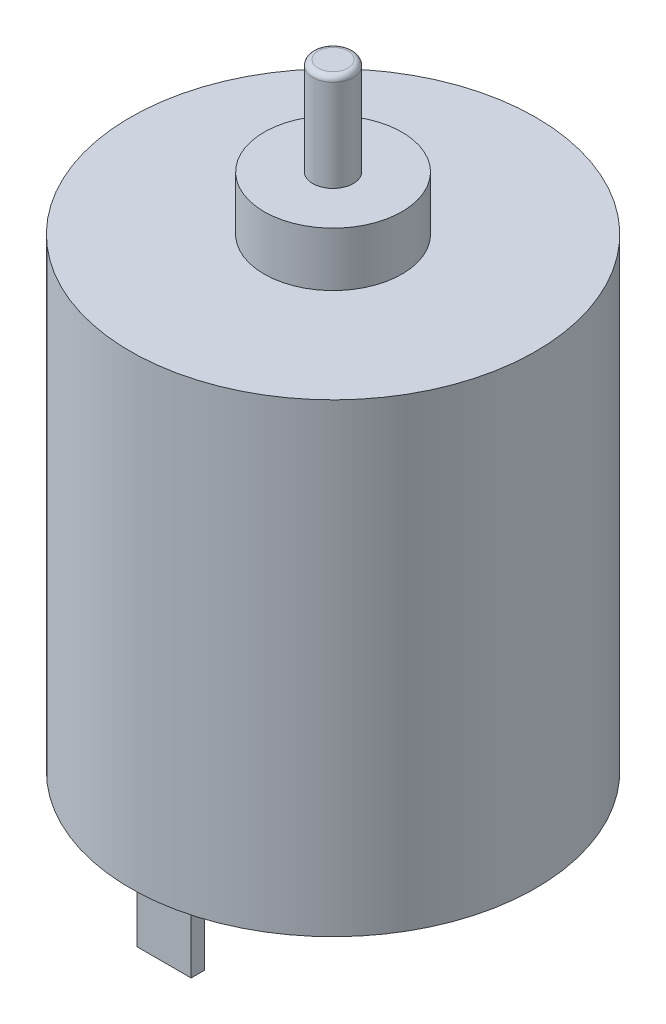
from build123d import *

# Parameters (mm, degrees)
SKETCH_1_R      = 7.5
EXTRUDE_1_DEPTH = 17.2
SKETCH_2_R      = 2.55
EXTRUDE_2_DEPTH = 2
SKETCH_3_R      = 0.75
EXTRUDE_3_DEPTH = 3.6
SKETCH_4_W      = 2
SKETCH_4_H      = 0.5
EXTRUDE_4_DEPTH = 3
FILLET_2_R      = 0.2


with BuildPart() as part:
    # 草圖1 → 伸長1 (new body)
    with BuildSketch(Plane(origin=(0, 0, 0), x_dir=(1, 0, 0), z_dir=(0, 1, 0))):
        with Locations(Location((0, 0, 0), (0, 0, 90))):
            Circle(SKETCH_1_R)
    extrude(amount=EXTRUDE_1_DEPTH)

    # 草圖2 → 伸長2 (add)
    with BuildSketch(Plane(origin=(0, 17.2, 0), x_dir=(1, 0, 0), z_dir=(0, 1, 0))):
        with Locations(Location((0, 0, 0), (0, 0, 270))):
            Circle(SKETCH_2_R)
    extrude(amount=EXTRUDE_2_DEPTH)

    # 草圖3 → 伸長3 (add)
    with BuildSketch(Plane(origin=(0, 19.2, 0), x_dir=(-1, 0, 0), z_dir=(0, 1, 0))):
        with Locations(Location((0, 0, 0), (0, 0, 90))):
            Circle(SKETCH_3_R)
    extrude(amount=EXTRUDE_3_DEPTH)

    # 草圖4 → 伸長4 (add)
    with BuildSketch(Plane.XZ):
        with Locations((0, 6)):
            Rectangle(SKETCH_4_W, SKETCH_4_H)
        with Locations((0, -6)):
            Rectangle(SKETCH_4_W, SKETCH_4_H)
    extrude(amount=EXTRUDE_4_DEPTH)

    # 圓角2
    fillet_2_edges = [part.edges().sort_by_distance(p)[0] for p in [
        (0, 22.8, -0.75),
    ]]
    fillet(fillet_2_edges, radius=FILLET_2_R)


solid = part.part
